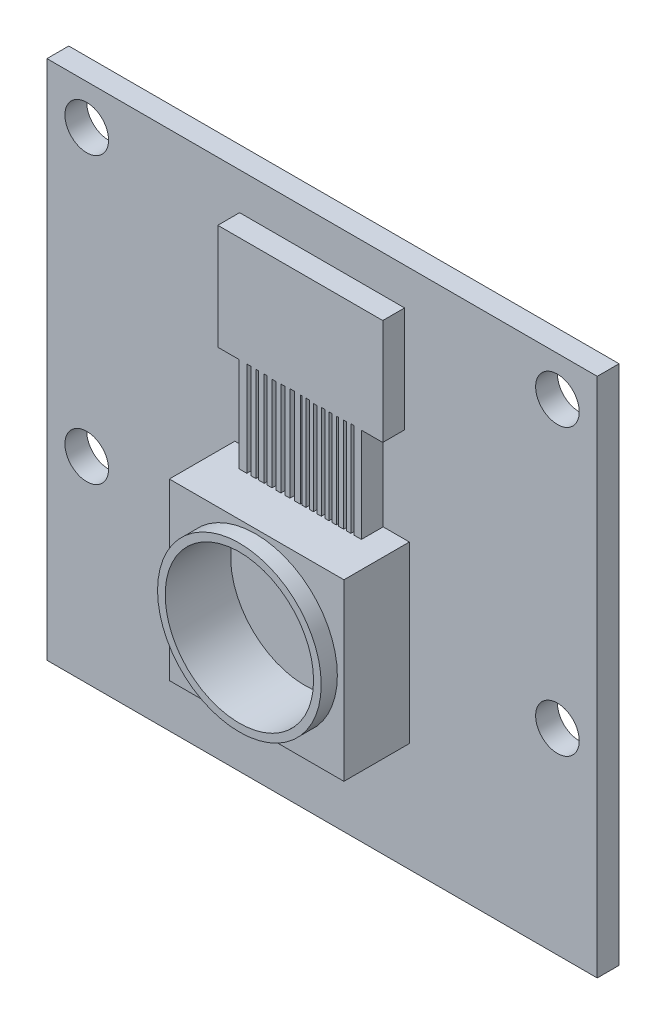
from build123d import *

# Parameters (mm, degrees)
SKETCH1_W               = 25.22
SKETCH1_H               = 23.88
BOSS_EXTRUDE1_DEPTH     = 1
CUT_EXTRUDE1_DEPTH      = 31
CUT_EXTRUDE1_DEPTH_BACK = 15
SKETCH2_R               = 1
BOSS_EXTRUDE2_DEPTH     = 3
SKETCH5_R               = 3.75
BOSS_EXTRUDE4_DEPTH     = 0.74
SKETCH6_R               = 3.4
CUT_EXTRUDE2_DEPTH      = 3
CUT_EXTRUDE3_DEPTH      = 16
CUT_EXTRUDE3_DEPTH_BACK = 20
SKETCH7_R               = 1
BOSS_EXTRUDE5_DEPTH     = 1
SKETCH9_W               = 0.2
SKETCH9_H               = 4.34
CUT_EXTRUDE8_DEPTH      = 1
SKETCH10_W              = 0.124682
SKETCH10_H              = 4.34
CUT_EXTRUDE14_DEPTH     = 1
SKETCH13_W              = 0.120984153
SKETCH13_H              = 4.34
CUT_EXTRUDE15_DEPTH     = 1
SKETCH14_W              = 0.195011185
SKETCH14_H              = 4.311792785
CUT_EXTRUDE18_DEPTH     = 1
SKETCH15_W              = 0.183717696
SKETCH15_H              = 4.326619606
CUT_EXTRUDE21_DEPTH     = 3
SKETCH16_W              = 0.21782098
SKETCH16_H              = 4.34679289
CUT_EXTRUDE22_DEPTH     = 1
SKETCH17_W              = 0.089131755
SKETCH17_H              = 4.34294968
CUT_EXTRUDE23_DEPTH     = 3
SKETCH18_W              = 0.156151398
SKETCH18_H              = 4.341783659
CUT_EXTRUDE24_DEPTH     = 3
SKETCH19_W              = 0.171903048
SKETCH19_H              = 4.300799657
CUT_EXTRUDE26_DEPTH     = 3
SKETCH20_W              = 0.170926161
SKETCH20_H              = 4.327306154
CUT_EXTRUDE28_DEPTH     = 3
SKETCH21_W              = 0.137513245
SKETCH21_H              = 4.32177715
CUT_EXTRUDE29_DEPTH     = 3
SKETCH22_W              = 0.100998317
SKETCH22_H              = 4.324558634
CUT_EXTRUDE30_DEPTH     = 3
SKETCH23_W              = 0.123761921
SKETCH23_H              = 4.331008445
CUT_EXTRUDE31_DEPTH     = 3
SKETCH24_W              = 0.133501637
SKETCH24_H              = 4.354790364
CUT_EXTRUDE32_DEPTH     = 3


with BuildPart() as part:
    # Sketch1 → Boss-Extrude1 (new body)
    with BuildSketch(Plane.XY):
        with Locations((-34.809454486, -6.615438712)):
            Rectangle(SKETCH1_W, SKETCH1_H)
    extrude(amount=BOSS_EXTRUDE1_DEPTH)

    # Sketch2 → Cut-Extrude1 (cut, two sides: drawn at the far end of the back side and taken through both)
    with BuildSketch(Plane.XY.offset(1).offset(-CUT_EXTRUDE1_DEPTH_BACK)):
        with Locations((-24.023789981, 3.500225793)):
            Circle(SKETCH2_R)
        with Locations((-45.59511899, 3.500225793)):
            Circle(SKETCH2_R)
    extrude(amount=CUT_EXTRUDE1_DEPTH + CUT_EXTRUDE1_DEPTH_BACK, mode=Mode.SUBTRACT)

    # Sketch3 → Boss-Extrude2 (add)
    with BuildSketch(Plane.XY.offset(1)):
        Polygon((-34.809454486, -13.555438712), (-30.809454486, -13.555438712), (-30.809454486, -5.555438712), (-38.809454486, -5.555438712), (-38.809454486, -13.555438712), align=None)
    extrude(amount=BOSS_EXTRUDE2_DEPTH)

    # Sketch5 → Boss-Extrude4 (add)
    with BuildSketch(Plane.XY.offset(4)):
        with Locations(Location((-34.860129967, -9.503941157, 0), (0, 0, 180))):
            Circle(SKETCH5_R)
    extrude(amount=BOSS_EXTRUDE4_DEPTH)

    # Sketch6 → Cut-Extrude2 (cut)
    with BuildSketch(Plane.XY.offset(4.74)):
        with Locations((-34.860129967, -9.503941157)):
            Circle(SKETCH6_R)
    extrude(amount=-CUT_EXTRUDE2_DEPTH, mode=Mode.SUBTRACT)

    # Sketch7 → Cut-Extrude3 (cut, two sides: drawn at the far end of the back side and taken through both)
    with BuildSketch(Plane.XY.offset(1).offset(-CUT_EXTRUDE3_DEPTH_BACK)):
        with Locations((-24.023789981, -9.555438712)):
            Circle(SKETCH7_R)
        with Locations((-45.59511899, -9.555438712)):
            Circle(SKETCH7_R)
    extrude(amount=CUT_EXTRUDE3_DEPTH + CUT_EXTRUDE3_DEPTH_BACK, mode=Mode.SUBTRACT)

    # Sketch8 → Boss-Extrude5 (add)
    with BuildSketch(Plane.XY.offset(1)):
        Polygon((-38.589454486, 3.624561288), (-38.589454486, -1.215438712), (-37.609454486, -1.215438712), (-37.609454486, -5.555438712), (-32.009454486, -5.555438712), (-32.009454486, -1.215438712), (-31.029454486, -1.215438712), (-31.029454486, 3.624561288), (-34.809454486, 3.624561288), align=None)
    extrude(amount=BOSS_EXTRUDE5_DEPTH)

    # Sketch9 → Cut-Extrude8 (cut)
    with BuildSketch(Plane.XY.offset(1)):
        with Locations((-37.159454486, -3.385438712)):
            Rectangle(SKETCH9_W, SKETCH9_H)
    extrude(amount=CUT_EXTRUDE8_DEPTH, mode=Mode.SUBTRACT)

    # Sketch10 → Cut-Extrude14 (cut)
    with BuildSketch(Plane.XY.offset(2)):
        with Locations((-36.775157633, -3.385438712)):
            Rectangle(SKETCH10_W, SKETCH10_H)
    extrude(amount=-CUT_EXTRUDE14_DEPTH, mode=Mode.SUBTRACT)

    # Sketch13 → Cut-Extrude15 (cut)
    with BuildSketch(Plane.XY.offset(2)):
        with Locations((-36.400540983, -3.385438712)):
            Rectangle(SKETCH13_W, SKETCH13_H)
    extrude(amount=-CUT_EXTRUDE15_DEPTH, mode=Mode.SUBTRACT)

    # Sketch14 → Cut-Extrude18 (cut)
    with BuildSketch(Plane.XY.offset(1)):
        with Locations((-36.007757653, -3.39954232)):
            Rectangle(SKETCH14_W, SKETCH14_H)
    extrude(amount=CUT_EXTRUDE18_DEPTH, mode=Mode.SUBTRACT)

    # Sketch15 → Cut-Extrude21 (cut)
    with BuildSketch(Plane.XY.offset(4)):
        with Locations((-35.606147547, -3.392128909)):
            Rectangle(SKETCH15_W, SKETCH15_H)
    extrude(amount=-CUT_EXTRUDE21_DEPTH, mode=Mode.SUBTRACT)

    # Sketch16 → Cut-Extrude22 (cut)
    with BuildSketch(Plane.XY.offset(2)):
        with Locations((-35.174485224, -3.382042267)):
            Rectangle(SKETCH16_W, SKETCH16_H)
    extrude(amount=-CUT_EXTRUDE22_DEPTH, mode=Mode.SUBTRACT)

    # Sketch17 → Cut-Extrude23 (cut)
    with BuildSketch(Plane.XY.offset(4)):
        with Locations((-34.764888609, -3.383963872)):
            Rectangle(SKETCH17_W, SKETCH17_H)
    extrude(amount=-CUT_EXTRUDE23_DEPTH, mode=Mode.SUBTRACT)

    # Sketch18 → Cut-Extrude24 (cut)
    with BuildSketch(Plane.XY.offset(4)):
        with Locations((-34.470187586, -3.384546883)):
            Rectangle(SKETCH18_W, SKETCH18_H)
    extrude(amount=-CUT_EXTRUDE24_DEPTH, mode=Mode.SUBTRACT)

    # Sketch19 → Cut-Extrude26 (cut)
    with BuildSketch(Plane.XY.offset(1)):
        with Locations((-34.122346996, -3.405038884)):
            Rectangle(SKETCH19_W, SKETCH19_H)
    extrude(amount=CUT_EXTRUDE26_DEPTH, mode=Mode.SUBTRACT)

    # Sketch20 → Cut-Extrude28 (cut)
    with BuildSketch(Plane.XY.offset(1)):
        with Locations((-33.761764477, -3.391785635)):
            Rectangle(SKETCH20_W, SKETCH20_H)
    extrude(amount=CUT_EXTRUDE28_DEPTH, mode=Mode.SUBTRACT)

    # Sketch21 → Cut-Extrude29 (cut)
    with BuildSketch(Plane.XY.offset(4)):
        with Locations((-33.427485819, -3.394550137)):
            Rectangle(SKETCH21_W, SKETCH21_H)
    extrude(amount=-CUT_EXTRUDE29_DEPTH, mode=Mode.SUBTRACT)

    # Sketch22 → Cut-Extrude30 (cut)
    with BuildSketch(Plane.XY.offset(4)):
        with Locations((-33.108230038, -3.393159395)):
            Rectangle(SKETCH22_W, SKETCH22_H)
    extrude(amount=-CUT_EXTRUDE30_DEPTH, mode=Mode.SUBTRACT)

    # Sketch23 → Cut-Extrude31 (cut)
    with BuildSketch(Plane.XY.offset(4)):
        with Locations((-32.761705251, -3.389934489)):
            Rectangle(SKETCH23_W, SKETCH23_H)
    extrude(amount=-CUT_EXTRUDE31_DEPTH, mode=Mode.SUBTRACT)

    # Sketch24 → Cut-Extrude32 (cut)
    with BuildSketch(Plane.XY.offset(4)):
        with Locations((-32.421390207, -3.37804353)):
            Rectangle(SKETCH24_W, SKETCH24_H)
    extrude(amount=-CUT_EXTRUDE32_DEPTH, mode=Mode.SUBTRACT)


solid = part.part
